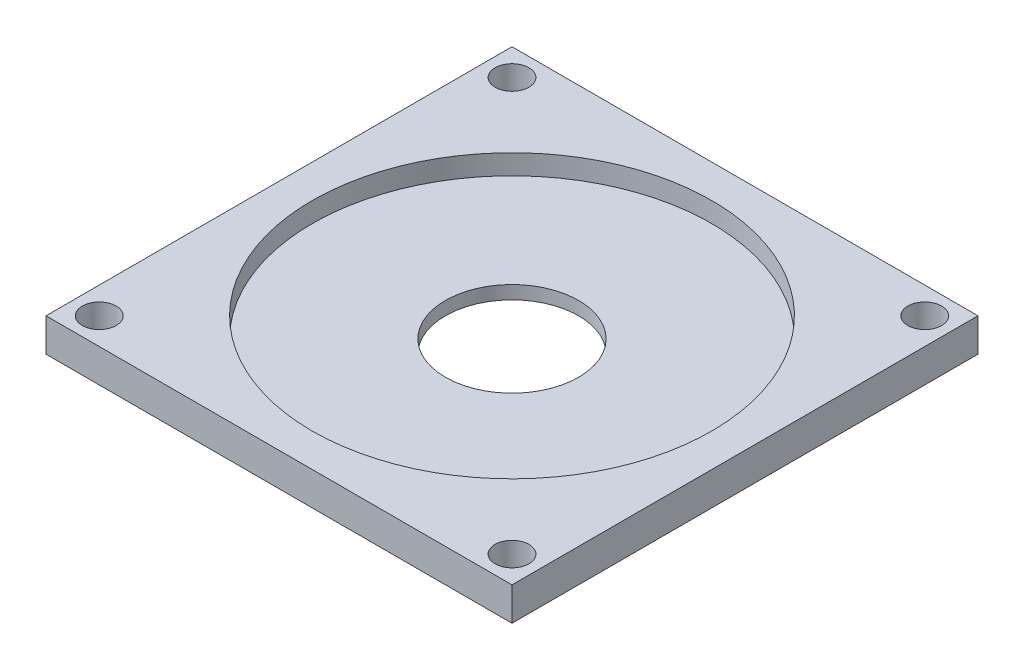
from build123d import *

# Parameters (mm, degrees)
CROQUIS2_W                 = 700
CROQUIS2_H                 = 700
SALIENTE_EXTRUIR1_DEPTH    = 50
CORTAR_EXTRUIR1_DEPTH      = 992.21138008
CORTAR_EXTRUIR1_DEPTH_BACK = 992.21138008
CROQUIS3_R                 = 25.4
CROQUIS4_R                 = 300
CORTAR_EXTRUIR4_DEPTH      = 30
CROQUIS5_R                 = 100
CORTAR_EXTRUIR5_DEPTH      = 20


with BuildPart() as part:
    # Croquis2 → Saliente-Extruir1 (new body)
    with BuildSketch(Plane(origin=(0, 0, 0), x_dir=(1, 0, 0), z_dir=(0, 1, 0))):
        with Locations((350, 350)):
            Rectangle(CROQUIS2_W, CROQUIS2_H)
    extrude(amount=SALIENTE_EXTRUIR1_DEPTH)

    # Croquis3 → Cortar-Extruir1 (cut, two sides: drawn at the far end of the back side and taken through both)
    with BuildSketch(Plane(origin=(0, 50, 0), x_dir=(1, 0, 0), z_dir=(0, 1, 0)).offset(-CORTAR_EXTRUIR1_DEPTH_BACK)):
        with Locations(Location((40, 40, 0), (0, 0, 270))):
            Circle(CROQUIS3_R)
        with Locations(Location((660, 40, 0), (0, 0, 270))):
            Circle(CROQUIS3_R)
        with Locations(Location((660, 660, 0), (0, 0, 270))):
            Circle(CROQUIS3_R)
        with Locations(Location((40, 660, 0), (0, 0, 270))):
            Circle(CROQUIS3_R)
    extrude(amount=CORTAR_EXTRUIR1_DEPTH + CORTAR_EXTRUIR1_DEPTH_BACK, mode=Mode.SUBTRACT)

    # Croquis4 → Cortar-Extruir4 (cut)
    with BuildSketch(Plane(origin=(0, 50, 0), x_dir=(1, 0, 0), z_dir=(0, 1, 0))):
        with Locations(Location((350, 350, 0), (0, 0, 270))):
            Circle(CROQUIS4_R)
    extrude(amount=-CORTAR_EXTRUIR4_DEPTH, mode=Mode.SUBTRACT)

    # Croquis5 → Cortar-Extruir5 (cut)
    with BuildSketch(Plane(origin=(0, 20, 0), x_dir=(1, 0, 0), z_dir=(0, 1, 0))):
        with Locations(Location((350, 350, 0), (0, 0, 270))):
            Circle(CROQUIS5_R)
    extrude(amount=-CORTAR_EXTRUIR5_DEPTH, mode=Mode.SUBTRACT)


solid = part.part
